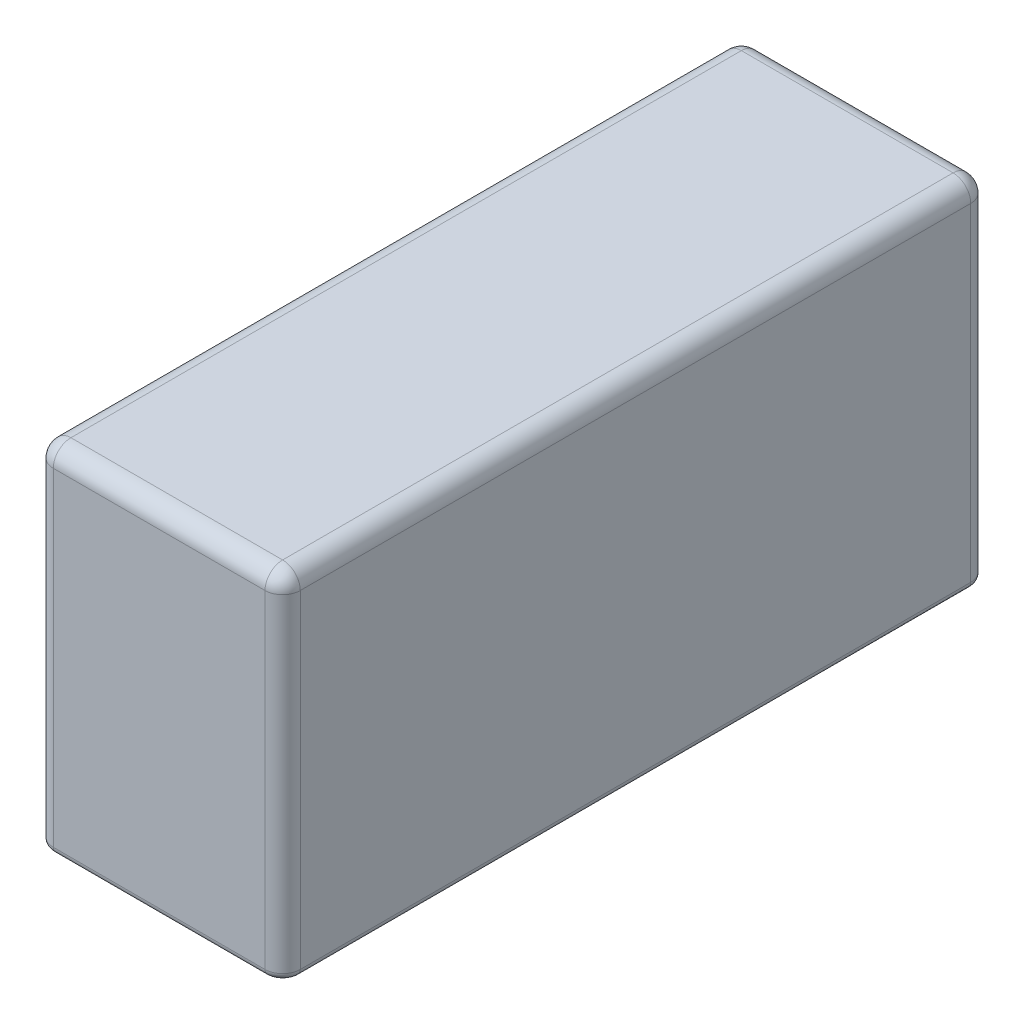
from build123d import *

# Parameters (mm, degrees)
SKETCH1_W           = 7
SKETCH1_H           = 20
BOSS_EXTRUDE1_DEPTH = 5
FILLET2_R           = 0.5
FILLET3_R           = 0.2


with BuildPart() as part:
    # Sketch1 → Boss-Extrude1 (new, symmetric)
    with BuildSketch(Plane(origin=(0, 0, 0), x_dir=(1, 0, 0), z_dir=(0, 1, 0))):
        Rectangle(SKETCH1_W, SKETCH1_H)
    extrude(amount=BOSS_EXTRUDE1_DEPTH, both=True)

    # Fillet2
    fillet2_edges = [part.edges().sort_by_distance(p)[0] for p in [
        (3.5, 5, 0),
        (0, 5, -10),
        (-3.5, 5, 0),
        (-3.5, 0, -10),
        (3.5, 0, -10),
        (3.5, 0, 10),
        (-3.5, 0, 10),
        (0, 5, 10),
    ]]
    fillet(fillet2_edges, radius=FILLET2_R)

    # Fillet3
    fillet3_edges = [part.edges().sort_by_distance(p)[0] for p in [
        (0, -5, -10),
        (3.5, -5, 0),
        (0, -5, 10),
        (-3.5, -5, 0),
        (3.353553391, -5, 9.853553391),
        (3.353553391, -5, -9.853553391),
        (-3.353553391, -5, 9.853553391),
        (-3.353553391, -5, -9.853553391),
    ]]
    fillet(fillet3_edges, radius=FILLET3_R)


solid = part.part
